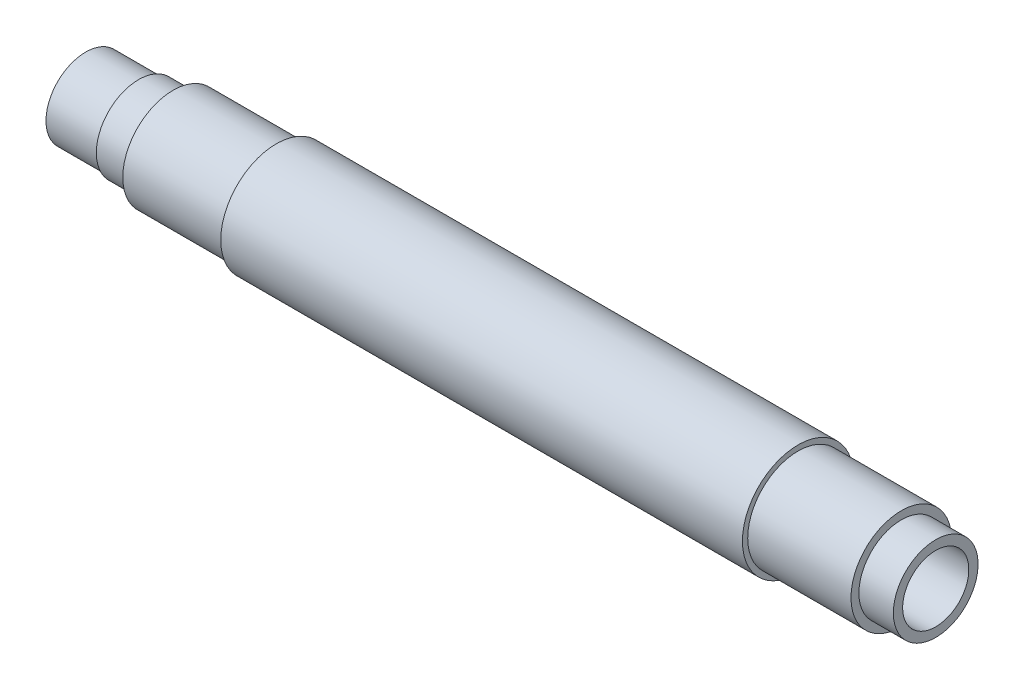
from build123d import *

# Parameters (mm, degrees)
SKETCH2_R      = 15
EXTRUDE1_DEPTH = 20


with BuildPart() as part:
    # Sketch1 → Revolve1 (revolve)
    with BuildSketch(Plane.XY, mode=Mode.PRIVATE) as revolve1_sk:
        Polygon((0, 21), (-98.5, 21), (-98.5, 19), (-137.5, 19), (-137.5, 16), (-150.5, 16), (-150.5, 15), (-170.5, 15), (-170.5, 12.5), (0, 12.5), align=None)
    revolve1 = revolve(revolve1_sk.sketch.rotate(Axis((0, 0, 0), (1, 0, 0)), 90), axis=Axis((0, 0, 0), (1, 0, 0)))

    # Mirror1: Revolve1 across plane
    add(revolve1.mirror(Plane(origin=(0, 0, 0), x_dir=(0, 0, 1), z_dir=(1, 0, 0))))

    # Sketch2 → Extrude1 (cut)
    with BuildSketch(Plane(origin=(170.5, 0, 0), x_dir=(0, 0, -1), z_dir=(1, 0, 0))):
        with Locations(Location((0, 0, 0), (0, 0, 180))):
            Circle(SKETCH2_R)
    extrude(amount=-EXTRUDE1_DEPTH, mode=Mode.SUBTRACT)


solid = part.part
